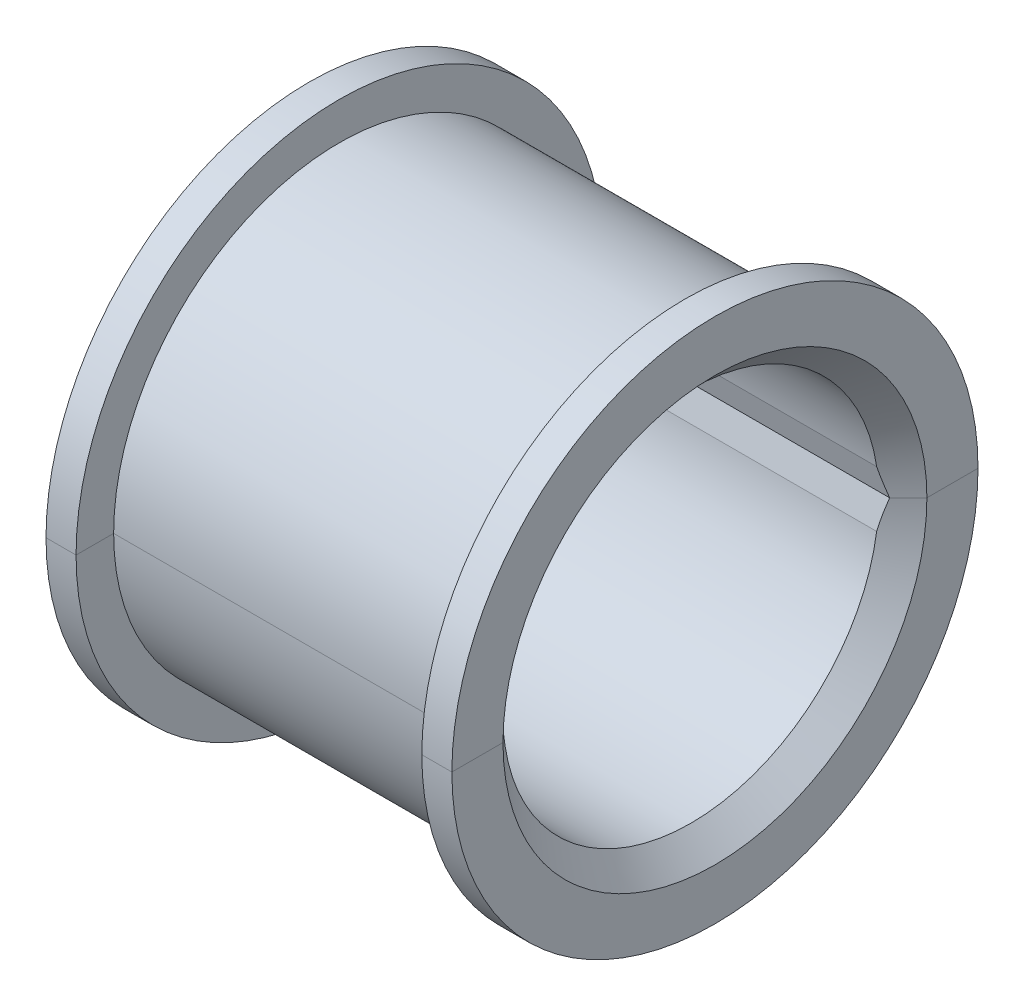
from build123d import *

# Parameters (mm, degrees)
REVOLVE_1_ANGLE     = 180
CUT_EXTRUDE_1_DEPTH = 37.626493144


with BuildPart() as part:
    # Эскиз1 → Повернуть1 (revolve, symmetric)
    with BuildSketch(Plane.XY) as revolve_1_sk:
        Polygon((0, 14.1), (0, 17.5), (2, 17.5), (2, 15), (25, 15), (25, 17.5), (27, 17.5), (27, 14.1), (25.4, 12.5), (1.6, 12.5), align=None)
    revolve(axis=Axis((-27.195971024, 0, 0), (1, 0, 0)), revolution_arc=REVOLVE_1_ANGLE / 2)
    revolve(revolve_1_sk.sketch, axis=Axis((-27.195971024, 0, 0), (-1, 0, 0)), revolution_arc=REVOLVE_1_ANGLE / 2)

    # Эскиз2 → Вырез-Вытянуть1 (cut, through all)
    with BuildSketch(Plane.ZY):
        Polygon((12.85993322, 0), (12.35993322, 1.866025404), (12.35993322, 0), align=None)
        Polygon((-12.85993322, 0), (-12.35993322, 1.866025404), (-12.35993322, 0), align=None)
    extrude(amount=-CUT_EXTRUDE_1_DEPTH, mode=Mode.SUBTRACT)


with BuildPart() as body_2:
    # Зеркальное отражение1: mirrored copy
    add(part.part.mirror(Plane.ZX))


solid = Compound([part.part, body_2.part])
